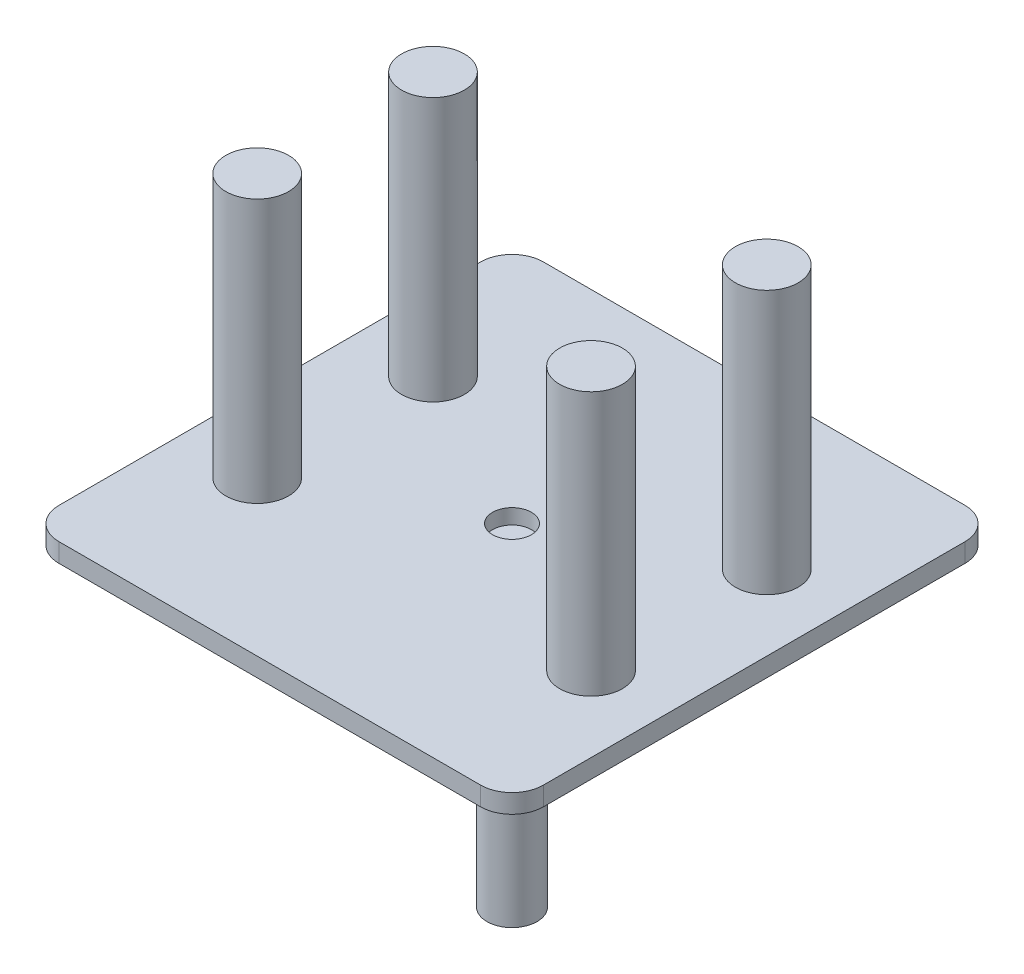
from build123d import *

# Parameters (mm, degrees)
DODANIE_WYCI_GNI_CIE1_DEPTH = 1.5
SZKIC1_4_R                  = 2.5
DODANIE_WYCI_GNI_CIE2_DEPTH = 22.5
SZKIC3_R                    = 1.55
WYTNIJ_WYCI_GNI_CIE2_DEPTH  = 1.2
SZKIC1_5_R                  = 2
DODANIE_WYCI_GNI_CIE3_DEPTH = 11
SZKIC2_R                    = 0.85
WYTNIJ_WYCI_GNI_CIE3_DEPTH  = 9


with BuildPart() as part:
    # Szkic1 → Dodanie-wyciągnięcie1 (new body)
    with BuildSketch(Plane(origin=(0, 0, 0), x_dir=(1, 0, 0), z_dir=(0, 1, 0))):
        with BuildLine():
            Line((16.795, -19.295), (-16.795, -19.295))
            ThreePointArc((-16.795, -19.295), (-18.562766953, -18.562766953), (-19.295, -16.795))
            Line((-19.295, -16.795), (-19.295, 16.795))
            ThreePointArc((-19.295, 16.795), (-18.562766953, 18.562766953), (-16.795, 19.295))
            Line((-16.795, 19.295), (16.795, 19.295))
            ThreePointArc((16.795, 19.295), (18.562766953, 18.562766953), (19.295, 16.795))
            Line((19.295, 16.795), (19.295, -16.795))
            ThreePointArc((19.295, -16.795), (18.562766953, -18.562766953), (16.795, -19.295))
        make_face()
    extrude(amount=DODANIE_WYCI_GNI_CIE1_DEPTH)

    # Szkic1<4> → Dodanie-wyciągnięcie2 (add)
    with BuildSketch(Plane(origin=(0, 0, 0), x_dir=(1, 0, 0), z_dir=(0, 1, 0))):
        with Locations((13.295, 7)):
            Circle(SZKIC1_4_R)
        with Locations((-13.295, 7)):
            Circle(SZKIC1_4_R)
        with Locations((13.295, -7)):
            Circle(SZKIC1_4_R)
        with Locations((-13.295, -7)):
            Circle(SZKIC1_4_R)
    extrude(amount=DODANIE_WYCI_GNI_CIE2_DEPTH)

    # Szkic3 → Wytnij-wyciągnięcie2 (cut)
    with BuildSketch(Plane.XZ.offset(-1.5)):
        Circle(SZKIC3_R)
    extrude(amount=WYTNIJ_WYCI_GNI_CIE2_DEPTH, mode=Mode.SUBTRACT)

    # Szkic1<5> → Dodanie-wyciągnięcie3 (add)
    with BuildSketch(Plane(origin=(0, 0, 0), x_dir=(1, 0, 0), z_dir=(0, 1, 0))):
        with Locations((13.965358928, -13.965358928)):
            Circle(SZKIC1_5_R)
        with Locations((-13.965358928, 13.965358928)):
            Circle(SZKIC1_5_R)
    extrude(amount=-DODANIE_WYCI_GNI_CIE3_DEPTH)

    # Szkic2 → Wytnij-wyciągnięcie3 (cut)
    with BuildSketch(Plane(origin=(0, -11, 0), x_dir=(1, 0, 0), z_dir=(0, 1, 0))):
        with Locations((-14, 14)):
            Circle(SZKIC2_R)
        with Locations((14, -14)):
            Circle(SZKIC2_R)
    extrude(amount=WYTNIJ_WYCI_GNI_CIE3_DEPTH, mode=Mode.SUBTRACT)


solid = part.part
